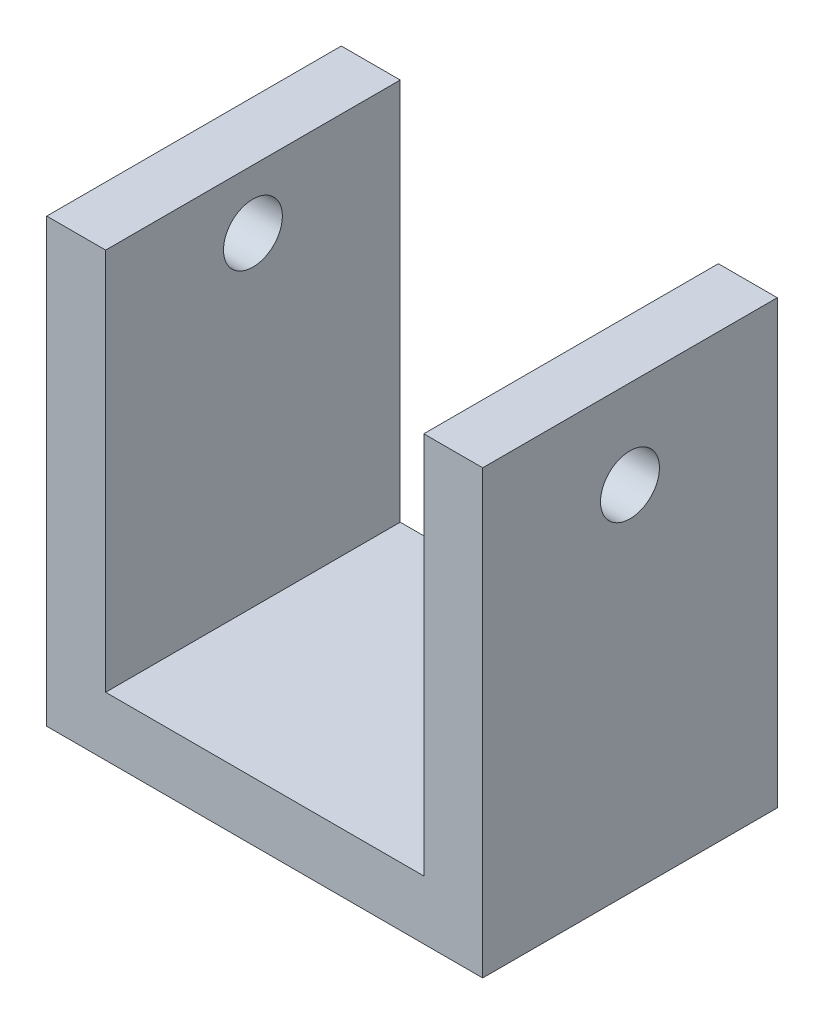
from build123d import *

# Parameters (mm, degrees)
SKETCH1_W           = 74
SKETCH1_H           = 50
BOSS_EXTRUDE1_DEPTH = 10
SKETCH2_W           = 10
SKETCH2_H           = 50
BOSS_EXTRUDE2_DEPTH = 65
SKETCH3_R           = 5
CUT_EXTRUDE1_DEPTH  = 60
SKETCH4_R           = 5
CUT_EXTRUDE3_DEPTH  = 60


with BuildPart() as part:
    # Sketch1 → Boss-Extrude1 (new body)
    with BuildSketch(Plane(origin=(0, 0, 0), x_dir=(1, 0, 0), z_dir=(0, 1, 0))):
        Rectangle(SKETCH1_W, SKETCH1_H)
    extrude(amount=BOSS_EXTRUDE1_DEPTH)

    # Sketch2 → Boss-Extrude2 (add)
    with BuildSketch(Plane(origin=(0, 10, 0), x_dir=(1, 0, 0), z_dir=(0, 1, 0))):
        with Locations((-32, 0)):
            Rectangle(SKETCH2_W, SKETCH2_H)
        with Locations((32, 0)):
            Rectangle(SKETCH2_W, SKETCH2_H)
    extrude(amount=BOSS_EXTRUDE2_DEPTH)

    # Sketch3 → Cut-Extrude1 (cut)
    with BuildSketch(Plane(origin=(-27, 0, 0), x_dir=(0, 0, -1), z_dir=(1, 0, 0))):
        with Locations((0, 65)):
            Circle(SKETCH3_R)
    extrude(amount=-CUT_EXTRUDE1_DEPTH, mode=Mode.SUBTRACT)

    # Sketch4 → Cut-Extrude3 (cut)
    with BuildSketch(Plane.ZY.offset(-27)):
        with Locations((0, 60)):
            Circle(SKETCH4_R)
    extrude(amount=-CUT_EXTRUDE3_DEPTH, mode=Mode.SUBTRACT)


solid = part.part
